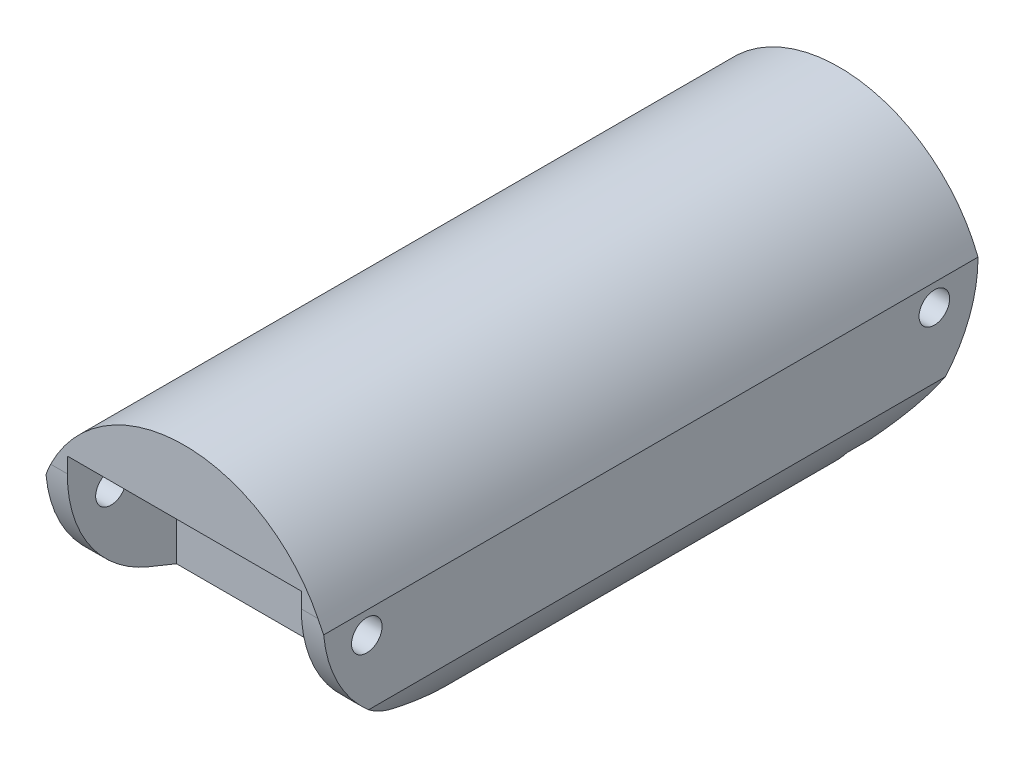
from build123d import *

# Parameters (mm, degrees)
BOSS_EXTRUDE1_DEPTH             = 19.05
CUT_EXTRUDE1_DEPTH              = 28.14022983
CUT_EXTRUDE2_DEPTH              = 43.723524845
BOSS_EXTRUDE2_DEPTH             = 16.1544
SKETCH7_W                       = 2.54
SKETCH7_H                       = 2.8575
CUT_EXTRUDE3_DEPTH              = 2.54
SKETCH9_W                       = 2.54
SKETCH9_H                       = 3.81
CUT_EXTRUDE5_DEPTH              = 27.350296534
SKETCH11_W                      = 2.54
SKETCH11_H                      = 3.81
CUT_EXTRUDE8_DEPTH              = 2.54
CUT_EXTRUDE9_DEPTH              = 1.27
SKETCH13_W                      = 3.81
SKETCH13_H                      = 5.9817
CUT_EXTRUDE10_DEPTH             = 1.27
CUT_EXTRUDE11_REACH             = 29.266
SKETCH14_W                      = 13.6144
SKETCH14_H                      = 6.35
CUT_EXTRUDE11_DIRECTION_2_DEPTH = 1.27
SKETCH10_R                      = 0.889
CUT_EXTRUDE7_DEPTH              = 28.14022983
CUT_EXTRUDE12_DEPTH             = 15.875
CUT_EXTRUDE13_DEPTH             = 15.875
FILLET1_R                       = 7.62
SKETCH21_W                      = 0.284935898
SKETCH21_H                      = 2.320192308
CUT_EXTRUDE14_DEPTH             = 1


with BuildPart() as part:
    # Sketch1 → Boss-Extrude1 (new, symmetric)
    with BuildSketch(Plane.XY):
        with BuildLine():
            Line((0, 0), (0, 5.08))
            ThreePointArc((0, 5.08), (8.0772, 10.6172), (16.1544, 5.08))
            Line((16.1544, 5.08), (16.1544, 0))
            ThreePointArc((16.1544, 0), (8.0772, -5.5372), (0, 0))
        make_face()
    extrude(amount=BOSS_EXTRUDE1_DEPTH, both=True)

    # Sketch2 → Cut-Extrude1 (cut, through all)
    with BuildSketch(Plane(origin=(0, 0, 0), x_dir=(0, 0, -1), z_dir=(1, 0, 0))):
        Polygon((-19.05, -5.5372), (-19.05, 0.635), (-3.81, -5.5372), align=None)
        Polygon((19.05, 0.635), (19.05, -5.5372), (8.359436006, -5.5372), align=None)
        with BuildLine():
            Line((-16.51, 1.27), (-19.05, 1.27))
            Line((-19.05, 1.27), (-19.05, 3.81))
            Line((-19.05, 3.81), (-16.51, 3.81))
            ThreePointArc((-16.51, 3.81), (-11.770295474, 2.54), (-16.51, 1.27))
        make_face()
        with BuildLine():
            Line((16.51, 1.27), (19.05, 1.27))
            Line((19.05, 1.27), (19.05, 3.81))
            Line((19.05, 3.81), (16.51, 3.81))
            ThreePointArc((16.51, 3.81), (11.770295474, 2.54), (16.51, 1.27))
        make_face()
    extrude(amount=CUT_EXTRUDE1_DEPTH, mode=Mode.SUBTRACT)

    # Sketch3 → Cut-Extrude2 (cut, through all)
    with BuildSketch(Plane.XY.offset(19.05)):
        with BuildLine():
            ThreePointArc((5.457741514, -3.743025472), (8.0772, -4.2672), (10.696658486, -3.743025472))
            ThreePointArc((10.696658486, -3.743025472), (8.0772, -2.3622), (5.457741514, -3.743025472))
        make_face()
    extrude(amount=-CUT_EXTRUDE2_DEPTH, mode=Mode.SUBTRACT)

    # Sketch4 → Boss-Extrude2 (add)
    with BuildSketch(Plane.ZY):
        with BuildLine():
            Line((19.05, 1.27), (16.51, 1.27))
            ThreePointArc((16.51, 1.27), (15.580295474, 0.340295474), (14.310295474, 0))
            ThreePointArc((14.310295474, 0), (11.770295474, 2.54), (14.310295474, 5.08))
            ThreePointArc((14.310295474, 5.08), (15.580295474, 4.739704526), (16.51, 3.81))
            Line((16.51, 3.81), (19.05, 3.81))
            Line((19.05, 3.81), (19.05, 1.27))
        make_face()
        with BuildLine():
            Line((-16.51, 1.27), (-19.05, 1.27))
            Line((-19.05, 1.27), (-19.05, 3.81))
            Line((-19.05, 3.81), (-16.51, 3.81))
            ThreePointArc((-16.51, 3.81), (-15.580295474, 4.739704526), (-14.310295474, 5.08))
            ThreePointArc((-14.310295474, 5.08), (-11.770295474, 2.54), (-14.310295474, 0))
            ThreePointArc((-14.310295474, 0), (-15.580295474, 0.340295474), (-16.51, 1.27))
        make_face()
    extrude(amount=-BOSS_EXTRUDE2_DEPTH)

    # Sketch7 → Cut-Extrude3 (cut)
    with BuildSketch(Plane.ZY.offset(-5.08)):
        with Locations((-17.78, 1.42875)):
            Rectangle(SKETCH7_W, SKETCH7_H)
    cut_extrude3 = extrude(amount=CUT_EXTRUDE3_DEPTH, mode=Mode.SUBTRACT)

    # Sketch9 → Cut-Extrude5 (cut, through all)
    with BuildSketch(Plane.XZ.offset(-2.8575)):
        with Locations((3.81, -17.145)):
            Rectangle(SKETCH9_W, SKETCH9_H)
    cut_extrude5 = extrude(amount=CUT_EXTRUDE5_DEPTH, mode=Mode.SUBTRACT)

    # Sketch11 → Cut-Extrude8 (cut)
    with BuildSketch(Plane.XZ.offset(-2.8575)):
        with Locations((3.81, -17.145)):
            Rectangle(SKETCH11_W, SKETCH11_H)
    cut_extrude8 = extrude(amount=-CUT_EXTRUDE8_DEPTH, mode=Mode.SUBTRACT)

    # Sketch12 → Cut-Extrude9 (cut)
    with BuildSketch(Plane(origin=(2.54, 0, 0), x_dir=(0, 0, -1), z_dir=(1, 0, 0))):
        Polygon((15.24, -1.564704526), (19.05, 0.635), (19.05, 5.3975), (15.24, 5.3975), align=None)
    cut_extrude9 = extrude(amount=-CUT_EXTRUDE9_DEPTH, mode=Mode.SUBTRACT)

    # Sketch13 → Cut-Extrude10 (cut)
    with BuildSketch(Plane(origin=(0, 0, -15.24), x_dir=(-1, 0, 0), z_dir=(0, 0, -1))):
        with Locations((-3.175, 2.40665)):
            Rectangle(SKETCH13_W, SKETCH13_H)
    cut_extrude10 = extrude(amount=-CUT_EXTRUDE10_DEPTH, mode=Mode.SUBTRACT)

    # Sketch14 → Cut-Extrude11 (cut, up to next)
    with BuildSketch(Plane.XZ.offset(-5.3975), mode=Mode.PRIVATE) as cut_extrude11_sk1:
        with Locations((8.0772, -15.875)):
            Rectangle(SKETCH14_W, SKETCH14_H)
    cut_extrude11_tool1 = extrude(cut_extrude11_sk1.sketch, amount=CUT_EXTRUDE11_REACH, mode=Mode.PRIVATE) & part.part
    cut_extrude11 = cut_extrude11_tool1.solids().sort_by_distance((8.0772, 5.3975, -15.875))[0]
    add(cut_extrude11, mode=Mode.SUBTRACT)

    # Sketch14 → Cut-Extrude11 direction 2 (cut)
    with BuildSketch(Plane.XZ.offset(-5.3975)):
        with Locations((8.0772, -15.875)):
            Rectangle(SKETCH14_W, SKETCH14_H)
    cut_extrude11_direction_2 = extrude(amount=-CUT_EXTRUDE11_DIRECTION_2_DEPTH, mode=Mode.SUBTRACT)

    # Mirror3: Cut-Extrude3, Cut-Extrude5, Cut-Extrude8, Cut-Extrude9, Cut-Extrude10, Cut-Extrude11, Cut-Extrude11 direction 2 across plane
    add(cut_extrude3.mirror(Plane.XY), mode=Mode.SUBTRACT)
    add(cut_extrude5.mirror(Plane.XY), mode=Mode.SUBTRACT)
    add(cut_extrude8.mirror(Plane.XY), mode=Mode.SUBTRACT)
    add(cut_extrude9.mirror(Plane.XY), mode=Mode.SUBTRACT)
    add(cut_extrude10.mirror(Plane.XY), mode=Mode.SUBTRACT)
    add(cut_extrude11.mirror(Plane.XY), mode=Mode.SUBTRACT)
    add(cut_extrude11_direction_2.mirror(Plane.XY), mode=Mode.SUBTRACT)

    # Sketch10 → Cut-Extrude7 (cut, through all)
    with BuildSketch(Plane.ZY):
        with Locations((-16.51, 3.81)):
            Circle(SKETCH10_R)
    cut_extrude7 = extrude(amount=-CUT_EXTRUDE7_DEPTH, mode=Mode.SUBTRACT)

    # Sketch16 → Cut-Extrude12 (cut)
    with BuildSketch(Plane(origin=(0, 0, -12.7), x_dir=(-1, 0, 0), z_dir=(0, 0, -1))):
        with BuildLine():
            Line((-6.0452, 6.3754), (-5.4102, 6.3754))
            ThreePointArc((-5.4102, 6.3754), (-5.0292, 5.9944), (-5.4102, 5.6134))
            Line((-5.4102, 5.6134), (-6.0452, 5.6134))
            ThreePointArc((-6.0452, 5.6134), (-6.4262, 5.9944), (-6.0452, 6.3754))
        make_face()
    extrude(amount=-CUT_EXTRUDE12_DEPTH, mode=Mode.SUBTRACT)

    # Sketch20 → Cut-Extrude13 (cut)
    with BuildSketch(Plane.XY.offset(12.7)):
        with BuildLine():
            Line((10.1092, 6.3754), (10.7442, 6.3754))
            ThreePointArc((10.7442, 6.3754), (11.1252, 5.9944), (10.7442, 5.6134))
            Line((10.7442, 5.6134), (10.1092, 5.6134))
            ThreePointArc((10.1092, 5.6134), (9.7282, 5.9944), (10.1092, 6.3754))
        make_face()
    extrude(amount=-CUT_EXTRUDE13_DEPTH, mode=Mode.SUBTRACT)

    # Fillet1
    fillet1_edges = [part.edges().sort_by_distance(p)[0] for p in [
        (15.5194, 0.635, -19.05),
        (0.635, 0.635, -19.05),
        (15.5194, 0.635, 19.05),
        (0.635, 0.635, 19.05),
    ]]
    fillet(fillet1_edges, radius=FILLET1_R)

    # Sketch21 → Cut-Extrude14 (cut)
    # profile 1 of 5: a face of its own
    with BuildSketch(Plane.ZY):
        Polygon((-6.879304684, 1.095928531), (-6.460169067, 4.270928531), (-6.419463939, 4.270928531), (-5.108631607, 1.665800326), (-3.800979364, 4.270928531), (-3.759638218, 4.270928531), (-3.337958531, 1.095928531), (-3.624166463, 1.095928531), (-3.92818289, 3.380503852), (-5.074286656, 1.095928531), (-5.138524436, 1.095928531), (-6.289080325, 3.385591993), (-6.592460734, 1.095928531), align=None)
    # profile 2 of 5: a face of its own
    with BuildSketch(Plane.ZY):
        with BuildLine():
            add(Edge.make_bspline(
                [(-2.66759595, 4.393043916), (-2.649914543, 4.392223721), (-2.61529095, 4.39061762), (-2.565222771, 4.376863995), (-2.519632482, 4.353550709), (-2.47919411, 4.322272712), (-2.444494184, 4.285488574), (-2.420200254, 4.242616125), (-2.404586152, 4.196298645), (-2.402700605, 4.163990671), (-2.401740582, 4.147541111)],
                knots=[0, 0, 0, 0, 1.055194115, 2.066272739, 3.074728998, 4.095836921, 5.109056067, 6.073838105, 7.019297344, 8, 8, 8, 8], degree=3))
            add(Edge.make_bspline(
                [(-2.401740582, 4.147541111), (-2.402722255, 4.131518562), (-2.404662908, 4.099843877), (-2.420188194, 4.054329371), (-2.444701224, 4.012052628), (-2.479171859, 3.975339912), (-2.519638378, 3.944079207), (-2.565221205, 3.920761336), (-2.615291362, 3.907008926), (-2.649914682, 3.905402658), (-2.66759595, 3.904582377)],
                knots=[0, 0, 0, 0, 0.96129708, 1.900370562, 2.859976407, 3.87933698, 4.906634145, 5.921202961, 6.938410037, 8, 8, 8, 8], degree=3))
            add(Edge.make_bspline(
                [(-2.66759595, 3.904582377), (-2.685075029, 3.905371338), (-2.719095771, 3.906906946), (-2.768414263, 3.921031177), (-2.813615822, 3.944087186), (-2.85413306, 3.975135225), (-2.887906164, 4.012278096), (-2.912488216, 4.05430357), (-2.927977646, 4.099850446), (-2.929923131, 4.131520768), (-2.930907248, 4.147541111)],
                knots=[0, 0, 0, 0, 1.054934014, 2.053291228, 3.073705704, 4.106921865, 5.123545215, 6.088680038, 7.033164197, 8, 8, 8, 8], degree=3))
            add(Edge.make_bspline(
                [(-2.930907248, 4.147541111), (-2.929944691, 4.163988382), (-2.928054168, 4.19629186), (-2.912476606, 4.242642354), (-2.888110923, 4.285261288), (-2.854110698, 4.322477276), (-2.813621773, 4.353542778), (-2.768412726, 4.376594168), (-2.719096177, 4.390719597), (-2.685075166, 4.39225504), (-2.66759595, 4.393043916)],
                knots=[0, 0, 0, 0, 0.98631895, 1.937192651, 2.907499808, 3.917963147, 4.944918757, 5.95915025, 6.951458133, 8, 8, 8, 8], degree=3))
        make_face()
    # profile 3 of 5: a face of its own
    with BuildSketch(Plane.ZY):
        with Locations((-2.666323915, 2.256024685)):
            Rectangle(SKETCH21_W, SKETCH21_H)
    # profile 4 of 5: a face of its own
    with BuildSketch(Plane.ZY):
        with BuildLine():
            Line((0.529028649, 4.352338788), (0.529028649, 1.095928531))
            Line((0.529028649, 1.095928531), (0.244092752, 1.095928531))
            Line((0.244092752, 1.095928531), (0.244092752, 1.497255655))
            add(Edge.make_bspline(
                [(0.244092752, 1.497255655), (0.211962849, 1.460934023), (0.149260939, 1.390051902), (0.044539353, 1.297448789), (-0.066466065, 1.220905597), (-0.183216549, 1.159083888), (-0.30560667, 1.112645379), (-0.433365121, 1.079637935), (-0.566544016, 1.058416385), (-0.657487224, 1.056297279), (-0.703573515, 1.055223403)],
                knots=[0, 0, 0, 0, 1.074387032, 2.096679803, 3.090159297, 4.057316773, 5.018401886, 5.985159533, 6.978961417, 8, 8, 8, 8], degree=3))
            add(Edge.make_bspline(
                [(-0.703573515, 1.055223403), (-0.744547301, 1.056335898), (-0.825349423, 1.058529787), (-0.944211514, 1.075549877), (-1.058595198, 1.102882655), (-1.16860856, 1.140892748), (-1.27353972, 1.191312493), (-1.374287094, 1.251674911), (-1.47032875, 1.323557664), (-1.560200789, 1.405733947), (-1.642961247, 1.494992256), (-1.715588258, 1.59019286), (-1.776142838, 1.690924093), (-1.826779625, 1.795910596), (-1.865783452, 1.905960559), (-1.89297382, 2.020693419), (-1.909974083, 2.139973518), (-1.912167065, 2.221198657), (-1.913279043, 2.262384861)],
                knots=[0, 0, 0, 0, 1.033919861, 2.038935746, 3.024066025, 3.998881131, 4.97069526, 5.957263378, 6.95902576, 7.993208707, 9.027059324, 10.027763471, 11.009749337, 11.988697705, 12.965288445, 13.950418724, 14.960734635, 16, 16, 16, 16], degree=3))
            add(Edge.make_bspline(
                [(-1.913279043, 2.262384861), (-1.912142419, 2.302719793), (-1.909895375, 2.382459775), (-1.893155668, 2.499734023), (-1.86500611, 2.612689874), (-1.825501992, 2.720963672), (-1.774845361, 2.824686432), (-1.713224882, 2.923931512), (-1.640636105, 3.018972322), (-1.556949993, 3.107574078), (-1.46629488, 3.189417064), (-1.369313388, 3.260545269), (-1.268417983, 3.321974125), (-1.16204368, 3.370645493), (-1.05176495, 3.410023752), (-0.936600038, 3.437267945), (-0.817028106, 3.453321943), (-0.735847445, 3.455646736), (-0.694669268, 3.456825967)],
                knots=[0, 0, 0, 0, 1.020392517, 2.01726096, 2.990465484, 3.961182959, 4.928053699, 5.906110375, 6.912531644, 7.948652711, 8.985773172, 9.998621852, 10.987621588, 11.969261332, 12.953316658, 13.946091881, 14.958173133, 16, 16, 16, 16], degree=3))
            add(Edge.make_bspline(
                [(-0.694669268, 3.456825967), (-0.647301164, 3.455404387), (-0.554322839, 3.452613984), (-0.418343466, 3.429294637), (-0.289721848, 3.39013974), (-0.167717495, 3.336535506), (-0.053057758, 3.266866254), (0.055097837, 3.18272744), (0.154868423, 3.081737815), (0.213897862, 3.005890173), (0.244092752, 2.967092394)],
                knots=[0, 0, 0, 0, 1.031072012, 2.023879775, 2.993683497, 3.952812103, 4.918022106, 5.908088563, 6.929940113, 8, 8, 8, 8], degree=3))
            Line((0.244092752, 2.967092394), (0.244092752, 4.352338788))
            Line((0.244092752, 4.352338788), (0.529028649, 4.352338788))
        make_face()
        with BuildLine():
            add(Edge.make_bspline(
                [(-0.690853162, 3.17189007), (-0.732504026, 3.170408127), (-0.814716206, 3.167483008), (-0.935406122, 3.144647051), (-1.050897576, 3.106651741), (-1.160612943, 3.054688873), (-1.262819111, 2.989348519), (-1.354162655, 2.910316979), (-1.435390677, 2.819750544), (-1.503706031, 2.718057916), (-1.559395982, 2.609039219), (-1.598554647, 2.495079907), (-1.624380321, 2.378235392), (-1.627018765, 2.298984955), (-1.628343146, 2.259204773)],
                knots=[0, 0, 0, 0, 1.031046209, 2.035121221, 3.029706178, 4.034933723, 5.034054252, 6.02443088, 7.017295772, 8.038157696, 9.050218397, 10.03989886, 11.016116709, 12, 12, 12, 12], degree=3))
            add(Edge.make_bspline(
                [(-1.628343146, 2.259204773), (-1.626651421, 2.219662319), (-1.623274603, 2.140732403), (-1.599007902, 2.023728594), (-1.558295445, 1.909742428), (-1.502740145, 1.799741383), (-1.433174421, 1.697611521), (-1.352539715, 1.605318696), (-1.260056246, 1.52595314), (-1.157614864, 1.459516199), (-1.048206205, 1.40584734), (-0.93314971, 1.368504225), (-0.814608239, 1.344394381), (-0.734006479, 1.341578177), (-0.693397232, 1.340159301)],
                knots=[0, 0, 0, 0, 0.979072187, 1.954306742, 2.945804271, 3.96968567, 4.997920485, 5.998718438, 6.996577872, 8.005894225, 9.015743152, 10.005417472, 10.995077863, 12, 12, 12, 12], degree=3))
            add(Edge.make_bspline(
                [(-0.693397232, 1.340159301), (-0.652170762, 1.341665125), (-0.570175401, 1.34466006), (-0.449127431, 1.36759378), (-0.331657, 1.405484047), (-0.2193643, 1.458006826), (-0.114756096, 1.523100999), (-0.020868735, 1.599307431), (0.058520751, 1.687938177), (0.125824046, 1.785343959), (0.17859746, 1.892125556), (0.217038599, 2.005821572), (0.239766071, 2.126435965), (0.242630583, 2.208862527), (0.244092752, 2.250936544)],
                knots=[0, 0, 0, 0, 1.01762866, 2.023962475, 3.030623092, 4.058876274, 5.077231937, 6.066672613, 7.034107872, 8.005628644, 8.981990164, 9.965428785, 10.961468474, 12, 12, 12, 12], degree=3))
            add(Edge.make_bspline(
                [(0.244092752, 2.250936544), (0.243222206, 2.282993005), (0.241508697, 2.346090264), (0.228418109, 2.438734512), (0.207594712, 2.527392963), (0.178252115, 2.612158831), (0.139706449, 2.692563452), (0.093217405, 2.769184149), (0.037967461, 2.841622419), (-0.025153985, 2.908880776), (-0.094246704, 2.970227639), (-0.167357466, 3.024986628), (-0.245352472, 3.069970729), (-0.32692007, 3.107201026), (-0.412201781, 3.13682754), (-0.501891557, 3.156592091), (-0.595036067, 3.170163239), (-0.658577846, 3.171308399), (-0.690853162, 3.17189007)],
                knots=[0, 0, 0, 0, 1.050140795, 2.067009409, 3.05949893, 4.030605086, 5.00011959, 5.97591094, 6.962425594, 7.979863591, 8.993523472, 9.986985069, 10.967611495, 11.937549037, 12.921786183, 13.919465291, 14.943216303, 16, 16, 16, 16], degree=3))
        make_face(mode=Mode.SUBTRACT)
    # profile 5 of 5: a face of its own
    with BuildSketch(Plane.ZY):
        with BuildLine():
            Line((2.604990187, 3.294005454), (2.32005429, 3.294005454))
            add(Edge.make_bspline(
                [(2.32005429, 3.294005454), (2.32191135, 3.331806903), (2.325558567, 3.406047941), (2.342638515, 3.51429177), (2.36707774, 3.617755766), (2.40163213, 3.715609188), (2.444545682, 3.808717249), (2.496007921, 3.89671012), (2.556962343, 3.979252127), (2.626092737, 4.055578078), (2.701175717, 4.125598231), (2.782188962, 4.186064059), (2.867319808, 4.237152232), (2.956309977, 4.279861644), (3.050163488, 4.311919933), (3.148028652, 4.335706706), (3.25033544, 4.350018106), (3.320040317, 4.351556425), (3.355490989, 4.352338788)],
                knots=[0, 0, 0, 0, 1.10065271, 2.161652631, 3.183658789, 4.190468796, 5.17591951, 6.163126047, 7.15150782, 8.156236427, 9.156009102, 10.134482811, 11.092018607, 12.041330605, 13.001268258, 13.972401359, 14.968799086, 16, 16, 16, 16], degree=3))
            add(Edge.make_bspline(
                [(3.355490989, 4.352338788), (3.390305384, 4.351523759), (3.458714429, 4.349922258), (3.558556399, 4.336169038), (3.653604373, 4.314628395), (3.743672561, 4.284406553), (3.828042348, 4.243780679), (3.907347539, 4.194978626), (3.982532274, 4.138536351), (4.050211285, 4.072084677), (4.1123579, 4.001143943), (4.165972089, 3.925408487), (4.211885458, 3.847186207), (4.250155711, 3.765880624), (4.278328065, 3.680726191), (4.299716868, 3.592962657), (4.311806736, 3.501681578), (4.313662228, 3.439899203), (4.314605572, 3.408488627)],
                knots=[0, 0, 0, 0, 1.111607364, 2.184268762, 3.212621178, 4.221274766, 5.211760367, 6.196651075, 7.1921475, 8.207485113, 9.220403448, 10.201281604, 11.166441695, 12.114753415, 13.065576456, 14.026450734, 14.996634279, 16, 16, 16, 16], degree=3))
            add(Edge.make_bspline(
                [(4.314605572, 3.408488627), (4.313069541, 3.364267378), (4.310024433, 3.276600898), (4.283976392, 3.14777313), (4.243294199, 3.022956242), (4.194310883, 2.92250169), (4.144896594, 2.841554163), (4.100367212, 2.774907552), (4.04823842, 2.703147592), (3.987751496, 2.626514579), (3.920157677, 2.544408258), (3.844844714, 2.456878229), (3.761275556, 2.364828838), (3.702621058, 2.301958756), (3.672227768, 2.269381055)],
                knots=[0, 0, 0, 0, 1.184426356, 2.348067706, 3.509069118, 4.696110526, 5.333549288, 6.050745305, 6.844228056, 7.710549037, 8.667450064, 9.695053472, 10.805634456, 12, 12, 12, 12], degree=3))
            Line((3.672227768, 2.269381055), (2.87784175, 1.421569557))
            Line((2.87784175, 1.421569557), (4.3553107, 1.421569557))
            Line((4.3553107, 1.421569557), (4.3553107, 1.095928531))
            Line((4.3553107, 1.095928531), (2.197938905, 1.095928531))
            Line((2.197938905, 1.095928531), (3.429269034, 2.409940951))
            add(Edge.make_bspline(
                [(3.429269034, 2.409940951), (3.459248188, 2.441235844), (3.516832008, 2.501346927), (3.598277632, 2.589106612), (3.671428714, 2.670522267), (3.736758777, 2.745440065), (3.7928506, 2.814955844), (3.842627553, 2.876818182), (3.882510625, 2.933745434), (3.925795305, 2.999731562), (3.967717989, 3.080297021), (4.003742769, 3.178752582), (4.025709096, 3.280105161), (4.028344196, 3.348596295), (4.029669675, 3.383047922)],
                knots=[0, 0, 0, 0, 1.329631726, 2.553950428, 3.673215718, 4.687767853, 5.603093632, 6.413772471, 7.123043292, 7.734684054, 8.834405432, 9.900288307, 10.943827018, 12, 12, 12, 12], degree=3))
            add(Edge.make_bspline(
                [(4.029669675, 3.383047922), (4.029092965, 3.404711762), (4.027956383, 3.447407031), (4.017925471, 3.510005112), (4.002766655, 3.570388908), (3.981044885, 3.628744155), (3.952373057, 3.684484139), (3.917472205, 3.737676711), (3.877204076, 3.789101701), (3.830621139, 3.837319335), (3.779447832, 3.881480143), (3.725387334, 3.920599849), (3.668191882, 3.953292471), (3.608102628, 3.980092644), (3.545287095, 4.001116025), (3.479623791, 4.015683451), (3.411294148, 4.024829704), (3.364636619, 4.026067203), (3.340862583, 4.026697762)],
                knots=[0, 0, 0, 0, 0.991446411, 1.95395049, 2.89581595, 3.838931463, 4.798493298, 5.75982156, 6.748411868, 7.785213223, 8.824556874, 9.840280684, 10.836137867, 11.835679398, 12.848801643, 13.863922112, 14.911575587, 16, 16, 16, 16], degree=3))
            add(Edge.make_bspline(
                [(3.340862583, 4.026697762), (3.316033328, 4.026049126), (3.26727277, 4.024775311), (3.195681933, 4.015864751), (3.127386977, 4.000492453), (3.062216108, 3.979467899), (3.000059056, 3.952744787), (2.941218101, 3.919460132), (2.885825337, 3.879742249), (2.833776634, 3.834711173), (2.785821453, 3.784575564), (2.743687501, 3.728686526), (2.706872003, 3.668064513), (2.67475077, 3.602873099), (2.648665251, 3.532520742), (2.628732464, 3.457257181), (2.612960111, 3.377409214), (2.607690953, 3.322268458), (2.604990187, 3.294005454)],
                knots=[0, 0, 0, 0, 1.031018746, 2.02475058, 2.990194455, 3.934040569, 4.864654155, 5.795059489, 6.735614925, 7.690564532, 8.649604399, 9.611025574, 10.590972636, 11.591080095, 12.624614302, 13.701020113, 14.821632451, 16, 16, 16, 16], degree=3))
        make_face()
    extrude(amount=-CUT_EXTRUDE14_DEPTH, mode=Mode.SUBTRACT)

    # Mirror4: Cut-Extrude7 across plane
    add(cut_extrude7.mirror(Plane(origin=(0, 0, 0), x_dir=(1, 0, 0), z_dir=(0, 0, -1))), mode=Mode.SUBTRACT)


solid = part.part
